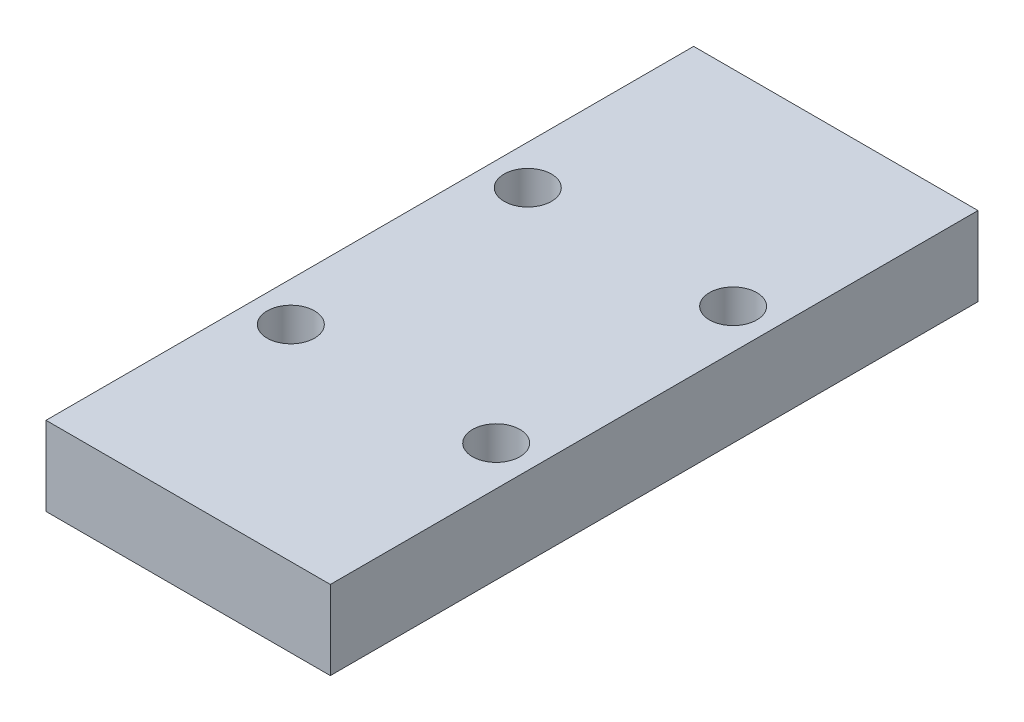
from build123d import *

# Parameters (mm, degrees)
SKETCH1_W           = 9
SKETCH1_H           = 41
SKETCH1_R           = 1.5
BOSS_EXTRUDE1_DEPTH = 5


with BuildPart() as part:
    # Sketch1 → Boss-Extrude1 (new body)
    with BuildSketch(Plane(origin=(0, 0, 0), x_dir=(1, 0, 0), z_dir=(0, 1, 0))):
        with Locations((4.5, 20.5)):
            Rectangle(SKETCH1_W, SKETCH1_H)
        with Locations(Location((2.5, 13, 0), (0, 0, 270))):
            Circle(SKETCH1_R, mode=Mode.SUBTRACT)
        with Locations(Location((2.5, 28, 0), (0, 0, 270))):
            Circle(SKETCH1_R, mode=Mode.SUBTRACT)
    boss_extrude1 = extrude(amount=BOSS_EXTRUDE1_DEPTH)

    # Mirror1: Boss-Extrude1 across plane
    add(boss_extrude1.mirror(Plane(origin=(9, 5, 0), x_dir=(0, 0, 1), z_dir=(-1, 0, 0))))


solid = part.part
